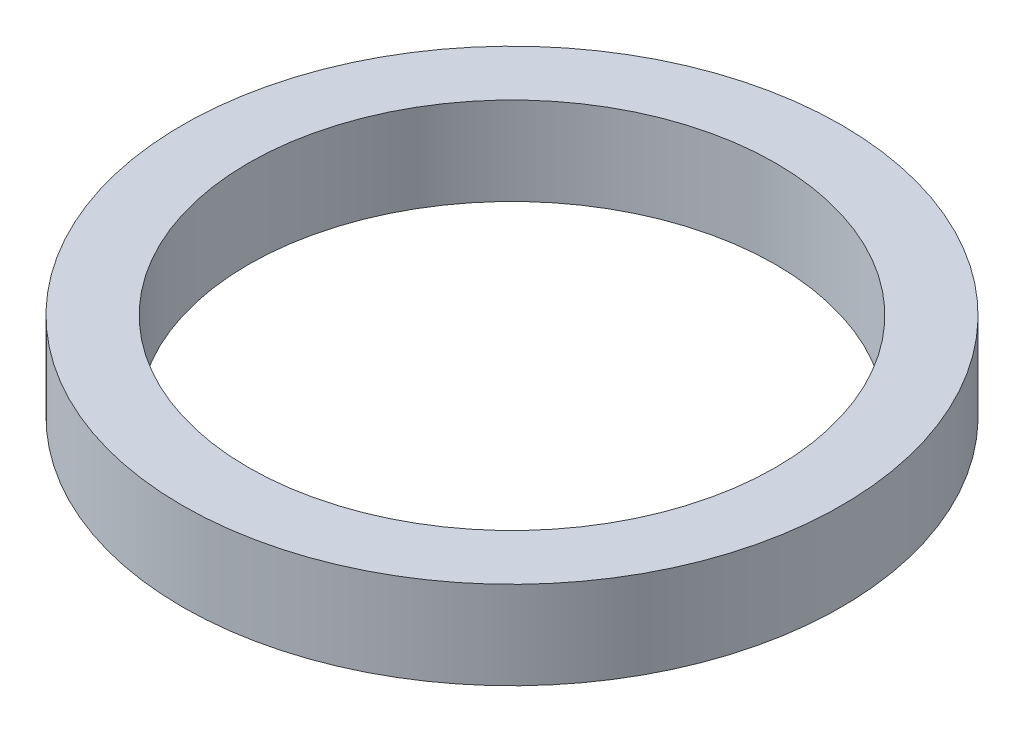
from build123d import *

# Parameters (mm, degrees)
SKETCH1_R           = 7.5
SKETCH1_R_2         = 6
BOSS_EXTRUDE1_DEPTH = 2


with BuildPart() as part:
    # Sketch1 → Boss-Extrude1 (new body)
    with BuildSketch(Plane(origin=(0, 0, 0), x_dir=(1, 0, 0), z_dir=(0, 1, 0))):
        with Locations(Location((0, 0, 0), (0, 0, 270))):
            Circle(SKETCH1_R)
        with Locations(Location((0, 0, 0), (0, 0, 270))):
            Circle(SKETCH1_R_2, mode=Mode.SUBTRACT)
    extrude(amount=BOSS_EXTRUDE1_DEPTH)


solid = part.part
